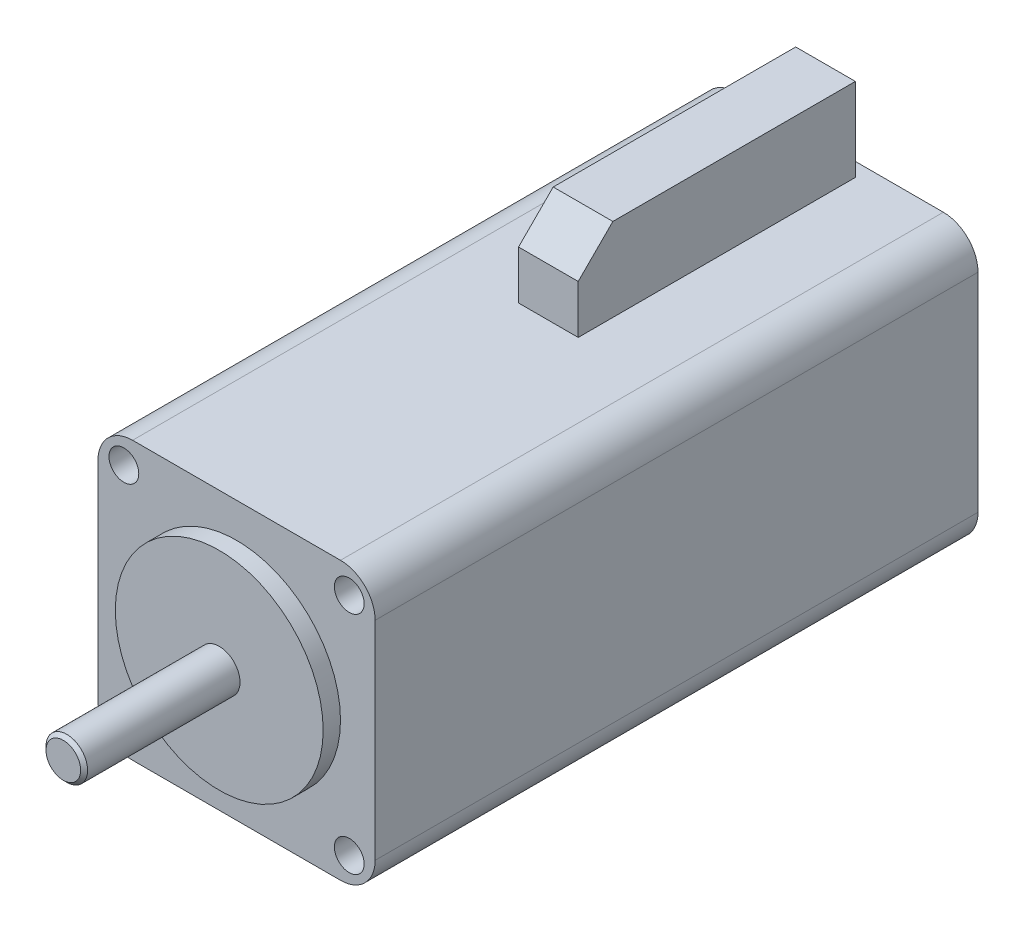
from build123d import *

# Parameters (mm, degrees)
SKETCH1_W           = 40
SKETCH1_H           = 40
BOSS_EXTRUDE1_DEPTH = 5
FILLET1_R           = 5
SKETCH2_R           = 15
BOSS_EXTRUDE2_DEPTH = 2.5
SKETCH3_R           = 3
BOSS_EXTRUDE3_DEPTH = 22.5
BOSS_EXTRUDE5_DEPTH = 82
CHAMFER1_SIZE       = 0.5
SKETCH5_R           = 2.15
CUT_EXTRUDE1_DEPTH  = 10
SKETCH6_W           = 8.611155486
SKETCH6_H           = 40
BOSS_EXTRUDE6_DEPTH = 12
CHAMFER2_SIZE       = 5


with BuildPart() as part:
    # Sketch1 → Boss-Extrude1 (new body)
    with BuildSketch(Plane.XY):
        Rectangle(SKETCH1_W, SKETCH1_H)
    extrude(amount=BOSS_EXTRUDE1_DEPTH)

    # Fillet1
    fillet1_edges = [part.edges().sort_by_distance(p)[0] for p in [
        (20, -20, 2.5),
        (-20, -20, 2.5),
        (-20, 20, 2.5),
        (20, 20, 2.5),
    ]]
    fillet(fillet1_edges, radius=FILLET1_R)

    # Sketch2 → Boss-Extrude2 (add)
    with BuildSketch(Plane.XY.offset(5)):
        Circle(SKETCH2_R)
    extrude(amount=BOSS_EXTRUDE2_DEPTH)

    # Sketch3 → Boss-Extrude3 (add)
    with BuildSketch(Plane.XY.offset(7.5)):
        with Locations(Location((0, 0, 0), (0, 0, 180))):
            Circle(SKETCH3_R)
    extrude(amount=BOSS_EXTRUDE3_DEPTH)

    # Sketch4 → Boss-Extrude5 (add)
    with BuildSketch(Plane(origin=(0, 0, 0), x_dir=(-1, 0, 0), z_dir=(0, 0, -1))):
        with BuildLine():
            Line((-20, -15), (-20, 15))
            ThreePointArc((-20, 15), (-18.535533906, 18.535533906), (-15, 20))
            Line((-15, 20), (15, 20))
            ThreePointArc((15, 20), (18.535533906, 18.535533906), (20, 15))
            Line((20, 15), (20, -15))
            ThreePointArc((20, -15), (18.535533906, -18.535533906), (15, -20))
            Line((15, -20), (-15, -20))
            ThreePointArc((-15, -20), (-18.535533906, -18.535533906), (-20, -15))
        make_face()
    extrude(amount=BOSS_EXTRUDE5_DEPTH)

    # Chamfer1
    chamfer1_edges = [part.edges().sort_by_distance(p)[0] for p in [
        (3, 0, 30),
    ]]
    chamfer(chamfer1_edges, length=CHAMFER1_SIZE)

    # Sketch5 → Cut-Extrude1 (cut)
    with BuildSketch(Plane.XY.offset(5)):
        with Locations((-16.263455967, 16.263455967)):
            Circle(SKETCH5_R)
        with Locations((16.263455967, 16.263455967)):
            Circle(SKETCH5_R)
        with Locations((16.263455967, -16.263455967)):
            Circle(SKETCH5_R)
        with Locations((-16.263455967, -16.263455967)):
            Circle(SKETCH5_R)
    extrude(amount=-CUT_EXTRUDE1_DEPTH, mode=Mode.SUBTRACT)

    # Sketch6 → Boss-Extrude6 (add)
    with BuildSketch(Plane(origin=(0, 20, 0), x_dir=(1, 0, 0), z_dir=(0, 1, 0))):
        with Locations((0, 60)):
            Rectangle(SKETCH6_W, SKETCH6_H)
    extrude(amount=BOSS_EXTRUDE6_DEPTH)

    # Chamfer2
    chamfer2_edges = [part.edges().sort_by_distance(p)[0] for p in [
        (0, 32, -40),
    ]]
    chamfer(chamfer2_edges, length=CHAMFER2_SIZE)


solid = part.part
